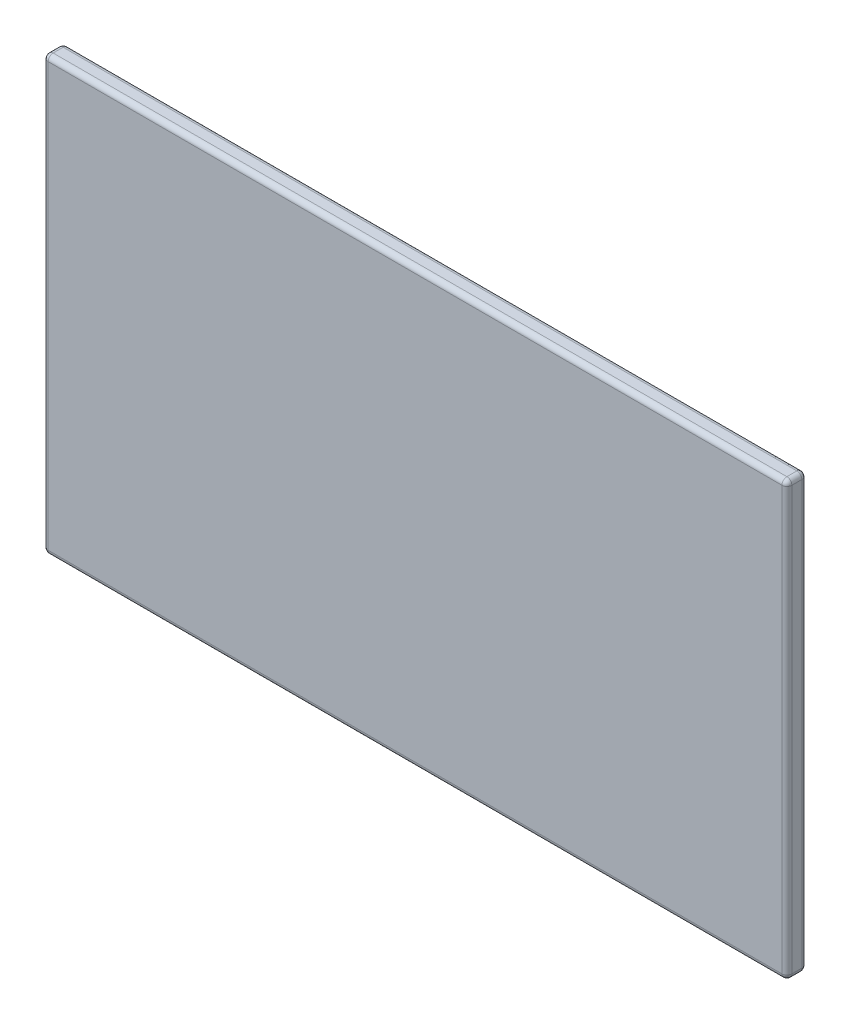
from build123d import *

# Parameters (mm, degrees)
SKETCH1_W           = 74.7
SKETCH1_H           = 43.5
BOSS_EXTRUDE1_DEPTH = 2
FILLET1_R           = 0.5


with BuildPart() as part:
    # Sketch1 → Boss-Extrude1 (new body)
    with BuildSketch(Plane.XY):
        Rectangle(SKETCH1_W, SKETCH1_H)
    extrude(amount=BOSS_EXTRUDE1_DEPTH)

    # Fillet1
    fillet1_edges = [part.edges().sort_by_distance(p)[0] for p in [
        (-37.35, 0, 2),
        (0, -21.75, 2),
        (37.35, 0, 2),
        (0, -21.75, 0),
        (-37.35, 0, 0),
        (0, 21.75, 0),
        (37.35, 0, 0),
        (37.35, -21.75, 1),
        (-37.35, -21.75, 1),
        (-37.35, 21.75, 1),
        (37.35, 21.75, 1),
        (0, 21.75, 2),
    ]]
    fillet(fillet1_edges, radius=FILLET1_R)


solid = part.part
